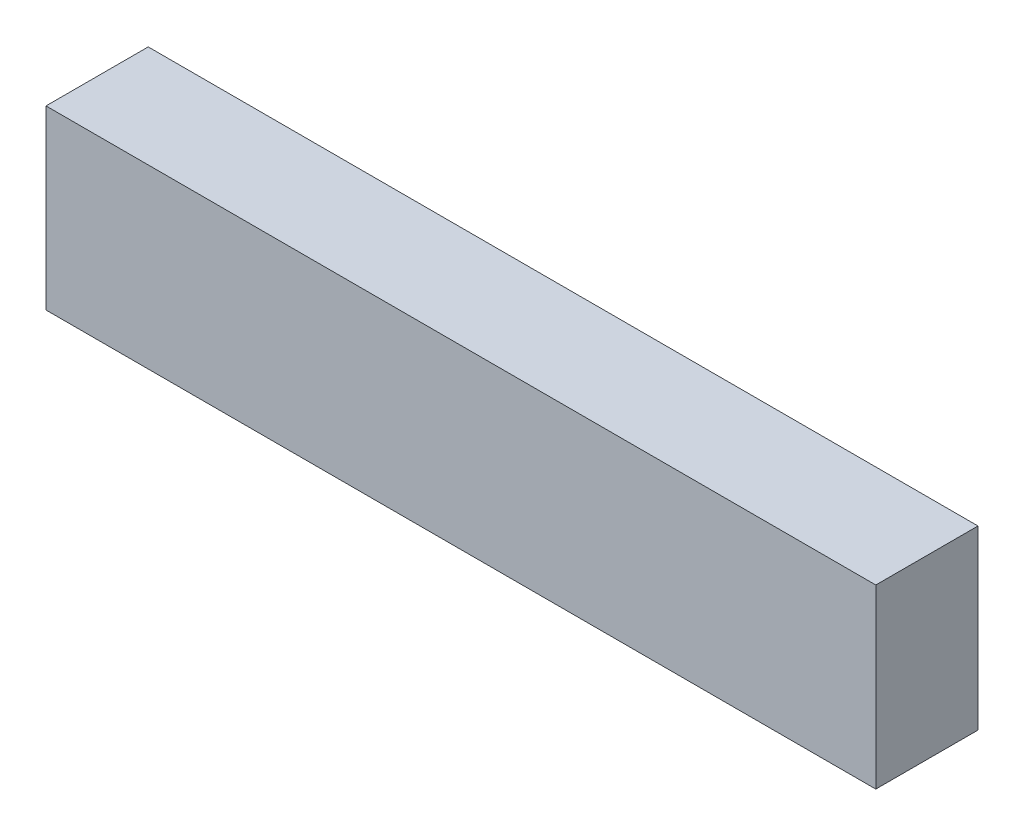
from build123d import *

# Parameters (mm, degrees)
SKETCH1_W                 = 58.86130149
SKETCH1_H                 = 12.54
BOSS_EXTRUDE1_DEPTH       = 7.25
SHELL1_T                  = -0.5
SHELL1_THICKNESS_2_FACE_W = 57.86130149
SHELL1_THICKNESS_2_FACE_H = 11.54
SHELL1_THICKNESS_2_DEPTH  = 0.3


with BuildPart() as part:
    # Sketch1 → Boss-Extrude1 (new body)
    with BuildSketch(Plane.XY):
        with Locations((-49.606150745, 23.92)):
            Rectangle(SKETCH1_W, SKETCH1_H)
    extrude(amount=BOSS_EXTRUDE1_DEPTH)

    # Shell1
    shell1_openings = [part.faces().sort_by_distance(p)[0] for p in [
        (-49.606150745, 23.92, 0),
    ]]
    offset(amount=SHELL1_T, openings=shell1_openings, kind=Kind.INTERSECTION)

    # Shell1 thickness 2 face (on inner face of the shell) → Shell1 thickness 2 (cut)
    with BuildSketch(Plane(origin=(-49.606150745, 23.92, 6.75), x_dir=(1, 0, 0), z_dir=(0, 0, 1))):
        Rectangle(SHELL1_THICKNESS_2_FACE_W, SHELL1_THICKNESS_2_FACE_H)
    extrude(amount=SHELL1_THICKNESS_2_DEPTH, mode=Mode.SUBTRACT)


solid = part.part
